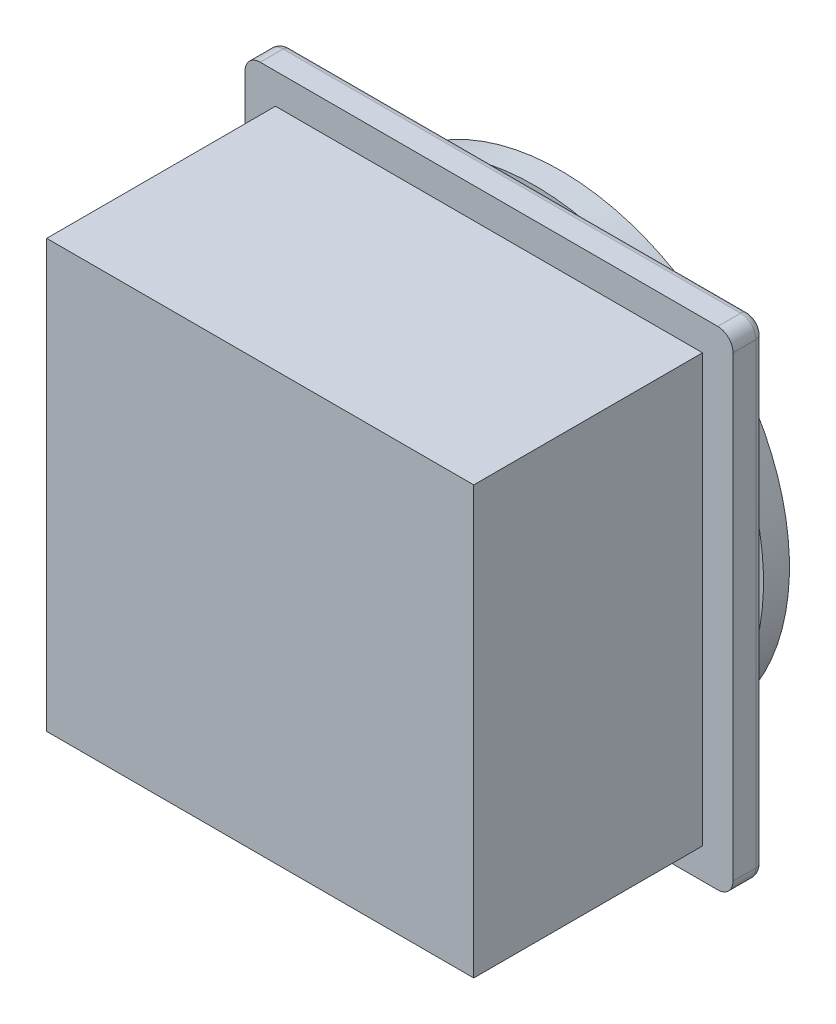
from build123d import *

# Parameters (mm, degrees)
SKETCH_1_W            = 280
SKETCH_1_H            = 280
EXTRUDE_1_DEPTH       = 150
SHELL_2_T             = -10
CUT_EXTRUDE_2_DEPTH   = 10
SKETCH_3_W            = 320
SKETCH_3_H            = 320
EXTRUDE_2_DEPTH       = 20
FILLET_1_R            = 10
FILLET_2_R            = 10
FILLET_3_R            = 5
SKETCH_4_R            = 75
EXTRUDE_3_DEPTH       = 10
SKETCH_5_R            = 150
EXTRUDE_4_DEPTH       = 17
SKETCH_6_R            = 5
EXTRUDE_5_DEPTH       = 3
FILLET_6_R            = 1
FILLET_7_R            = 1
FILLET_8_R            = 1
CUT_EXTRUDE_3_DEPTH   = 1
MIRROR_2_COPY_1_DEPTH = 1


with BuildPart() as part:
    # 草图1 → 凸台-拉伸1 (new body)
    with BuildSketch(Plane.XY):
        Rectangle(SKETCH_1_W, SKETCH_1_H)
    extrude(amount=EXTRUDE_1_DEPTH)

    # 抽壳2
    shell_2_openings = [part.faces().sort_by_distance(p)[0] for p in [
        (0, 0, 0),
    ]]
    offset(amount=SHELL_2_T, openings=shell_2_openings, kind=Kind.INTERSECTION)

    # 草图2 → 切除-拉伸2 (cut)
    with BuildSketch(Plane.XZ.offset(140)):
        with BuildLine():
            Line((-100.855157914, 105.72024925), (-100.855157914, 55.72024925))
            ThreePointArc((-100.855157914, 55.72024925), (-98.355157914, 53.22024925), (-95.855157914, 55.72024925))
            Line((-95.855157914, 55.72024925), (-95.855157914, 105.72024925))
            ThreePointArc((-95.855157914, 105.72024925), (-98.355157914, 108.22024925), (-100.855157914, 105.72024925))
        make_face()
        with BuildLine():
            Line((-70.855157914, 105.72024925), (-70.855157914, 55.72024925))
            ThreePointArc((-70.855157914, 55.72024925), (-68.355157914, 53.22024925), (-65.855157914, 55.72024925))
            Line((-65.855157914, 55.72024925), (-65.855157914, 105.72024925))
            ThreePointArc((-65.855157914, 105.72024925), (-68.355157914, 108.22024925), (-70.855157914, 105.72024925))
        make_face()
        with BuildLine():
            Line((-40.855157914, 105.72024925), (-40.855157914, 55.72024925))
            ThreePointArc((-40.855157914, 55.72024925), (-38.355157914, 53.22024925), (-35.855157914, 55.72024925))
            Line((-35.855157914, 55.72024925), (-35.855157914, 105.72024925))
            ThreePointArc((-35.855157914, 105.72024925), (-38.355157914, 108.22024925), (-40.855157914, 105.72024925))
        make_face()
        with BuildLine():
            Line((-10.855157914, 105.72024925), (-10.855157914, 55.72024925))
            ThreePointArc((-10.855157914, 55.72024925), (-8.355157914, 53.22024925), (-5.855157914, 55.72024925))
            Line((-5.855157914, 55.72024925), (-5.855157914, 105.72024925))
            ThreePointArc((-5.855157914, 105.72024925), (-8.355157914, 108.22024925), (-10.855157914, 105.72024925))
        make_face()
        with BuildLine():
            Line((19.144842086, 105.72024925), (19.144842086, 55.72024925))
            ThreePointArc((19.144842086, 55.72024925), (21.644842086, 53.22024925), (24.144842086, 55.72024925))
            Line((24.144842086, 55.72024925), (24.144842086, 105.72024925))
            ThreePointArc((24.144842086, 105.72024925), (21.644842086, 108.22024925), (19.144842086, 105.72024925))
        make_face()
        with BuildLine():
            Line((49.144842086, 105.72024925), (49.144842086, 55.72024925))
            ThreePointArc((49.144842086, 55.72024925), (51.644842086, 53.22024925), (54.144842086, 55.72024925))
            Line((54.144842086, 55.72024925), (54.144842086, 105.72024925))
            ThreePointArc((54.144842086, 105.72024925), (51.644842086, 108.22024925), (49.144842086, 105.72024925))
        make_face()
        with BuildLine():
            Line((79.144842086, 105.72024925), (79.144842086, 55.72024925))
            ThreePointArc((79.144842086, 55.72024925), (81.644842086, 53.22024925), (84.144842086, 55.72024925))
            Line((84.144842086, 55.72024925), (84.144842086, 105.72024925))
            ThreePointArc((84.144842086, 105.72024925), (81.644842086, 108.22024925), (79.144842086, 105.72024925))
        make_face()
        with BuildLine():
            Line((109.144842086, 105.72024925), (109.144842086, 55.72024925))
            ThreePointArc((109.144842086, 55.72024925), (111.644842086, 53.22024925), (114.144842086, 55.72024925))
            Line((114.144842086, 55.72024925), (114.144842086, 105.72024925))
            ThreePointArc((114.144842086, 105.72024925), (111.644842086, 108.22024925), (109.144842086, 105.72024925))
        make_face()
    extrude(amount=-CUT_EXTRUDE_2_DEPTH, mode=Mode.SUBTRACT)

    # 草图3 → 凸台-拉伸2 (add)
    with BuildSketch(Plane(origin=(0, 0, 0), x_dir=(-1, 0, 0), z_dir=(0, 0, -1))):
        Rectangle(SKETCH_3_W, SKETCH_3_H)
    extrude(amount=EXTRUDE_2_DEPTH)

    # 圆角1
    fillet_1_edges = [part.edges().sort_by_distance(p)[0] for p in [
        (-160, -160, -10),
    ]]
    fillet(fillet_1_edges, radius=FILLET_1_R)

    # 圆角2
    fillet_2_edges = [part.edges().sort_by_distance(p)[0] for p in [
        (-160, 160, -10),
        (160, 160, -10),
        (160, -160, -10),
    ]]
    fillet(fillet_2_edges, radius=FILLET_2_R)

    # 圆角3
    fillet_3_edges = [part.edges().sort_by_distance(p)[0] for p in [
        (-160, 0, -20),
        (-157.071067812, -157.071067812, -20),
        (0, -160, -20),
        (160, 0, -20),
        (0, 160, -20),
        (-157.071067812, 157.071067812, -20),
        (157.071067812, 157.071067812, -20),
        (157.071067812, -157.071067812, -20),
    ]]
    fillet(fillet_3_edges, radius=FILLET_3_R)

    # 草图4 → 凸台-拉伸3 (add)
    with BuildSketch(Plane(origin=(0, 0, -20), x_dir=(-1, 0, 0), z_dir=(0, 0, -1))):
        Circle(SKETCH_4_R)
    extrude(amount=EXTRUDE_3_DEPTH)

    # 草图5 → 凸台-拉伸4 (add)
    with BuildSketch(Plane(origin=(0, 0, -30), x_dir=(-1, 0, 0), z_dir=(0, 0, -1))):
        Circle(SKETCH_5_R)
    extrude(amount=EXTRUDE_4_DEPTH)

    # 草图6 → 凸台-拉伸5 (add)
    with BuildSketch(Plane(origin=(0, 0, -20), x_dir=(-1, 0, 0), z_dir=(0, 0, -1))):
        with Locations((-124.64951843, 125)):
            Circle(SKETCH_6_R)
        with Locations(Location((124.64951843, 125, 0), (0, 0, 180))):
            Circle(SKETCH_6_R)
        with Locations((124.64951843, -125)):
            Circle(SKETCH_6_R)
        with Locations(Location((-124.64951843, -125, 0), (0, 0, 180))):
            Circle(SKETCH_6_R)
    extrude(amount=EXTRUDE_5_DEPTH)

    # 圆角6
    fillet_6_edges = [part.edges().sort_by_distance(p)[0] for p in [
        (119.64951843, -125, -23),
    ]]
    fillet(fillet_6_edges, radius=FILLET_6_R)

    # 圆角7
    fillet_7_edges = [part.edges().sort_by_distance(p)[0] for p in [
        (-119.64951843, -125, -23),
    ]]
    fillet(fillet_7_edges, radius=FILLET_7_R)

    # 圆角8
    fillet_8_edges = [part.edges().sort_by_distance(p)[0] for p in [
        (-129.64951843, 125, -23),
        (129.64951843, 125, -23),
    ]]
    fillet(fillet_8_edges, radius=FILLET_8_R)

    # 草图7 → 切除-拉伸3 (cut)
    with BuildSketch(Plane(origin=(0, 0, -23), x_dir=(-1, 0, 0), z_dir=(0, 0, -1))):
        Polygon((-125.14951843, 127.912135043), (-124.14951843, 127.912135043), (-124.14951843, 125.5), (-121.444432989, 125.5), (-121.444432989, 124.5), (-124.14951843, 124.5), (-124.14951843, 122.087864957), (-125.14951843, 122.087864957), (-125.14951843, 124.5), (-127.854603871, 124.5), (-127.854603871, 125.5), (-125.14951843, 125.5), align=None)
    cut_extrude_3 = extrude(amount=-CUT_EXTRUDE_3_DEPTH, mode=Mode.SUBTRACT)

    # 镜向1: 切除-拉伸3 across plane
    add(cut_extrude_3.mirror(Plane(origin=(0, 0, 0), x_dir=(0, 0, 1), z_dir=(0, -1, 0))), mode=Mode.SUBTRACT)

    # 镜向2: 切除-拉伸3 across plane
    add(cut_extrude_3.mirror(Plane.ZY), mode=Mode.SUBTRACT)

    # 镜向2 copy 1 sketch → 镜向2 copy 1 (cut)
    with BuildSketch(Plane(origin=(0, 0, -23), x_dir=(1, 0, 0), z_dir=(0, 0, -1))):
        Polygon((-125.14951843, 127.912135043), (-124.14951843, 127.912135043), (-124.14951843, 125.5), (-121.444432989, 125.5), (-121.444432989, 124.5), (-124.14951843, 124.5), (-124.14951843, 122.087864957), (-125.14951843, 122.087864957), (-125.14951843, 124.5), (-127.854603871, 124.5), (-127.854603871, 125.5), (-125.14951843, 125.5), align=None)
    extrude(amount=-MIRROR_2_COPY_1_DEPTH, mode=Mode.SUBTRACT)


solid = part.part
